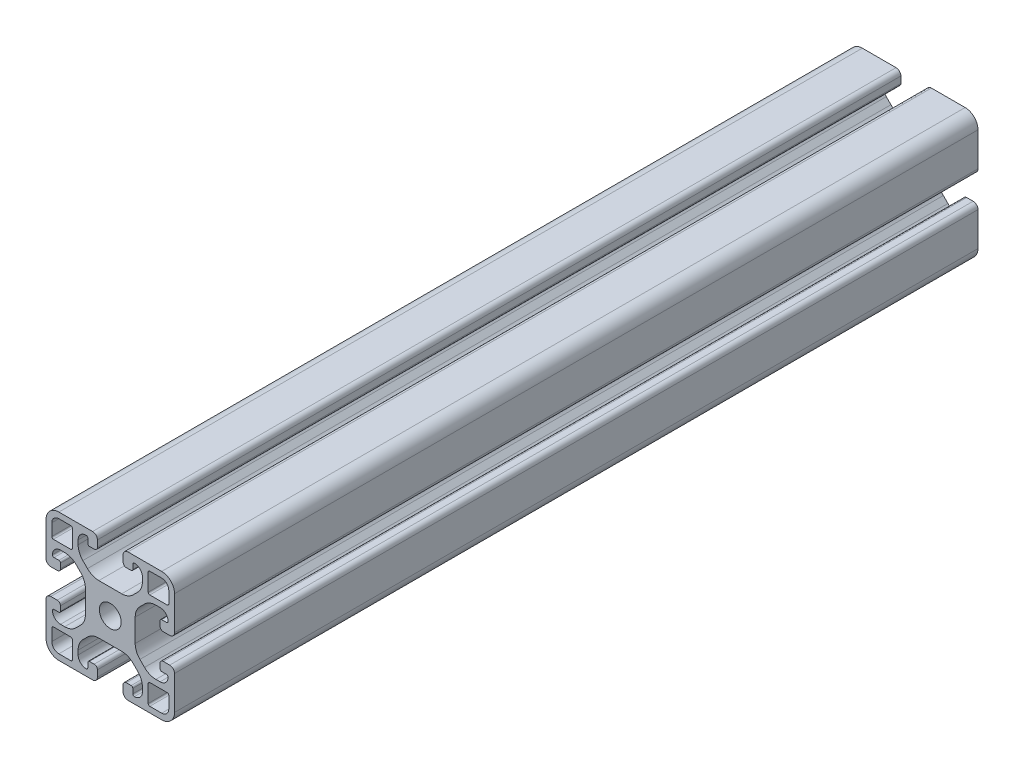
from build123d import *

# Parameters (mm, degrees)
SKETCH1_R           = 3.4
BOSS_EXTRUDE1_DEPTH = 250


with BuildPart() as part:
    # Sketch1 → Boss-Extrude1 (new body)
    with BuildSketch(Plane.XY):
        with BuildLine():
            Line((0, 36), (0, 25.5))
            ThreePointArc((0, 25.5), (0.439339828, 24.439339828), (1.5, 24))
            Line((1.5, 24), (3.5, 24))
            ThreePointArc((3.5, 24), (4.207106781, 24.292893219), (4.5, 25))
            Line((4.5, 25), (4.5, 26.5))
            ThreePointArc((4.5, 26.5), (4.353553391, 26.853553391), (4, 27))
            Line((4, 27), (2.5, 27))
            ThreePointArc((2.5, 27), (2.146446609, 27.146446609), (2, 27.5))
            ThreePointArc((2, 27.5), (2.732233047, 29.267766953), (4.5, 30))
            Line((4.5, 30), (5.807611845, 30))
            ThreePointArc((5.807611845, 30), (7.721029006, 29.619397663), (9.343145751, 28.535533906))
            Line((9.343145751, 28.535533906), (10.785533906, 27.093145751))
            ThreePointArc((10.785533906, 27.093145751), (11.869397663, 25.471029006), (12.25, 23.557611845))
            Line((12.25, 23.557611845), (12.25, 16.442388155))
            ThreePointArc((12.25, 16.442388155), (11.869397663, 14.528970994), (10.785533906, 12.906854249))
            Line((10.785533906, 12.906854249), (9.343145751, 11.464466094))
            ThreePointArc((9.343145751, 11.464466094), (7.721029006, 10.380602337), (5.807611845, 10))
            Line((5.807611845, 10), (4.5, 10))
            ThreePointArc((4.5, 10), (2.732233047, 10.732233047), (2, 12.5))
            ThreePointArc((2, 12.5), (2.146446609, 12.853553391), (2.5, 13))
            Line((2.5, 13), (4, 13))
            ThreePointArc((4, 13), (4.353553391, 13.146446609), (4.5, 13.5))
            Line((4.5, 13.5), (4.5, 15))
            ThreePointArc((4.5, 15), (4.207106781, 15.707106781), (3.5, 16))
            Line((3.5, 16), (1.5, 16))
            ThreePointArc((1.5, 16), (0.439339828, 15.560660172), (0, 14.5))
            Line((0, 14.5), (0, 4))
            ThreePointArc((0, 4), (1.171572875, 1.171572875), (4, 0))
            Line((4, 0), (14.5, 0))
            ThreePointArc((14.5, 0), (15.560660172, 0.439339828), (16, 1.5))
            Line((16, 1.5), (16, 3.5))
            ThreePointArc((16, 3.5), (15.707106781, 4.207106781), (15, 4.5))
            Line((15, 4.5), (13.5, 4.5))
            ThreePointArc((13.5, 4.5), (13.146446609, 4.353553391), (13, 4))
            Line((13, 4), (13, 2.5))
            ThreePointArc((13, 2.5), (12.853553391, 2.146446609), (12.5, 2))
            ThreePointArc((12.5, 2), (10.732233047, 2.732233047), (10, 4.5))
            Line((10, 4.5), (10, 5.807611845))
            ThreePointArc((10, 5.807611845), (10.380602337, 7.721029006), (11.464466094, 9.343145751))
            Line((11.464466094, 9.343145751), (12.906854249, 10.785533906))
            ThreePointArc((12.906854249, 10.785533906), (14.528970994, 11.869397663), (16.442388155, 12.25))
            Line((16.442388155, 12.25), (23.557611845, 12.25))
            ThreePointArc((23.557611845, 12.25), (25.471029006, 11.869397663), (27.093145751, 10.785533906))
            Line((27.093145751, 10.785533906), (28.535533906, 9.343145751))
            ThreePointArc((28.535533906, 9.343145751), (29.619397663, 7.721029006), (30, 5.807611845))
            Line((30, 5.807611845), (30, 4.5))
            ThreePointArc((30, 4.5), (29.267766953, 2.732233047), (27.5, 2))
            ThreePointArc((27.5, 2), (27.146446609, 2.146446609), (27, 2.5))
            Line((27, 2.5), (27, 4))
            ThreePointArc((27, 4), (26.853553391, 4.353553391), (26.5, 4.5))
            Line((26.5, 4.5), (25, 4.5))
            ThreePointArc((25, 4.5), (24.292893219, 4.207106781), (24, 3.5))
            Line((24, 3.5), (24, 1.5))
            ThreePointArc((24, 1.5), (24.439339828, 0.439339828), (25.5, 0))
            Line((25.5, 0), (36, 0))
            ThreePointArc((36, 0), (38.828427125, 1.171572875), (40, 4))
            Line((40, 4), (40, 14.5))
            ThreePointArc((40, 14.5), (39.560660172, 15.560660172), (38.5, 16))
            Line((38.5, 16), (36.5, 16))
            ThreePointArc((36.5, 16), (35.792893219, 15.707106781), (35.5, 15))
            Line((35.5, 15), (35.5, 13.5))
            ThreePointArc((35.5, 13.5), (35.646446609, 13.146446609), (36, 13))
            Line((36, 13), (37.5, 13))
            ThreePointArc((37.5, 13), (37.853553391, 12.853553391), (38, 12.5))
            ThreePointArc((38, 12.5), (37.267766953, 10.732233047), (35.5, 10))
            Line((35.5, 10), (34.192388155, 10))
            ThreePointArc((34.192388155, 10), (32.278970994, 10.380602337), (30.656854249, 11.464466094))
            Line((30.656854249, 11.464466094), (29.214466094, 12.906854249))
            ThreePointArc((29.214466094, 12.906854249), (28.130602337, 14.528970994), (27.75, 16.442388155))
            Line((27.75, 16.442388155), (27.75, 23.557611845))
            ThreePointArc((27.75, 23.557611845), (28.130602337, 25.471029006), (29.214466094, 27.093145751))
            Line((29.214466094, 27.093145751), (30.656854249, 28.535533906))
            ThreePointArc((30.656854249, 28.535533906), (32.278970994, 29.619397663), (34.192388155, 30))
            Line((34.192388155, 30), (35.5, 30))
            ThreePointArc((35.5, 30), (37.267766953, 29.267766953), (38, 27.5))
            ThreePointArc((38, 27.5), (37.853553391, 27.146446609), (37.5, 27))
            Line((37.5, 27), (36, 27))
            ThreePointArc((36, 27), (35.646446609, 26.853553391), (35.5, 26.5))
            Line((35.5, 26.5), (35.5, 25))
            ThreePointArc((35.5, 25), (35.792893219, 24.292893219), (36.5, 24))
            Line((36.5, 24), (38.5, 24))
            ThreePointArc((38.5, 24), (39.560660172, 24.439339828), (40, 25.5))
            Line((40, 25.5), (40, 36))
            ThreePointArc((40, 36), (38.828427125, 38.828427125), (36, 40))
            Line((36, 40), (25.5, 40))
            ThreePointArc((25.5, 40), (24.439339828, 39.560660172), (24, 38.5))
            Line((24, 38.5), (24, 36.5))
            ThreePointArc((24, 36.5), (24.292893219, 35.792893219), (25, 35.5))
            Line((25, 35.5), (26.5, 35.5))
            ThreePointArc((26.5, 35.5), (26.853553391, 35.646446609), (27, 36))
            Line((27, 36), (27, 37.5))
            ThreePointArc((27, 37.5), (27.146446609, 37.853553391), (27.5, 38))
            ThreePointArc((27.5, 38), (29.267766953, 37.267766953), (30, 35.5))
            Line((30, 35.5), (30, 34.192388155))
            ThreePointArc((30, 34.192388155), (29.619397663, 32.278970994), (28.535533906, 30.656854249))
            Line((28.535533906, 30.656854249), (27.093145751, 29.214466094))
            ThreePointArc((27.093145751, 29.214466094), (25.471029006, 28.130602337), (23.557611845, 27.75))
            Line((23.557611845, 27.75), (16.442388155, 27.75))
            ThreePointArc((16.442388155, 27.75), (14.528970994, 28.130602337), (12.906854249, 29.214466094))
            Line((12.906854249, 29.214466094), (11.464466094, 30.656854249))
            ThreePointArc((11.464466094, 30.656854249), (10.380602337, 32.278970994), (10, 34.192388155))
            Line((10, 34.192388155), (10, 35.5))
            ThreePointArc((10, 35.5), (10.732233047, 37.267766953), (12.5, 38))
            ThreePointArc((12.5, 38), (12.853553391, 37.853553391), (13, 37.5))
            Line((13, 37.5), (13, 36))
            ThreePointArc((13, 36), (13.146446609, 35.646446609), (13.5, 35.5))
            Line((13.5, 35.5), (15, 35.5))
            ThreePointArc((15, 35.5), (15.707106781, 35.792893219), (16, 36.5))
            Line((16, 36.5), (16, 38.5))
            ThreePointArc((16, 38.5), (15.560660172, 39.560660172), (14.5, 40))
            Line((14.5, 40), (4, 40))
            ThreePointArc((4, 40), (1.171572875, 38.828427125), (0, 36))
        make_face()
        with Locations(Location((20, 20, 0), (0, 0, 180))):
            Circle(SKETCH1_R, mode=Mode.SUBTRACT)
        with BuildLine():
            Line((1.8, 4), (1.8, 7.7))
            ThreePointArc((1.8, 7.7), (1.946446609, 8.053553391), (2.3, 8.2))
            Line((2.3, 8.2), (7.7, 8.2))
            ThreePointArc((7.7, 8.2), (8.053553391, 8.053553391), (8.2, 7.7))
            Line((8.2, 7.7), (8.2, 2.3))
            ThreePointArc((8.2, 2.3), (8.053553391, 1.946446609), (7.7, 1.8))
            Line((7.7, 1.8), (4, 1.8))
            ThreePointArc((4, 1.8), (2.444365081, 2.444365081), (1.8, 4))
        make_face(mode=Mode.SUBTRACT)
        with BuildLine():
            Line((4, 38.2), (7.7, 38.2))
            ThreePointArc((7.7, 38.2), (8.053553391, 38.053553391), (8.2, 37.7))
            Line((8.2, 37.7), (8.2, 32.3))
            ThreePointArc((8.2, 32.3), (8.053553391, 31.946446609), (7.7, 31.8))
            Line((7.7, 31.8), (2.3, 31.8))
            ThreePointArc((2.3, 31.8), (1.946446609, 31.946446609), (1.8, 32.3))
            Line((1.8, 32.3), (1.8, 36))
            ThreePointArc((1.8, 36), (2.444365081, 37.555634919), (4, 38.2))
        make_face(mode=Mode.SUBTRACT)
        with BuildLine():
            Line((31.8, 32.3), (31.8, 37.7))
            ThreePointArc((31.8, 37.7), (31.946446609, 38.053553391), (32.3, 38.2))
            Line((32.3, 38.2), (36, 38.2))
            ThreePointArc((36, 38.2), (37.555634919, 37.555634919), (38.2, 36))
            Line((38.2, 36), (38.2, 32.3))
            ThreePointArc((38.2, 32.3), (38.053553391, 31.946446609), (37.7, 31.8))
            Line((37.7, 31.8), (32.3, 31.8))
            ThreePointArc((32.3, 31.8), (31.946446609, 31.946446609), (31.8, 32.3))
        make_face(mode=Mode.SUBTRACT)
        with BuildLine():
            Line((32.3, 8.2), (37.7, 8.2))
            ThreePointArc((37.7, 8.2), (38.053553391, 8.053553391), (38.2, 7.7))
            Line((38.2, 7.7), (38.2, 4))
            ThreePointArc((38.2, 4), (37.555634919, 2.444365081), (36, 1.8))
            Line((36, 1.8), (32.3, 1.8))
            ThreePointArc((32.3, 1.8), (31.946446609, 1.946446609), (31.8, 2.3))
            Line((31.8, 2.3), (31.8, 7.7))
            ThreePointArc((31.8, 7.7), (31.946446609, 8.053553391), (32.3, 8.2))
        make_face(mode=Mode.SUBTRACT)
    extrude(amount=-BOSS_EXTRUDE1_DEPTH)


solid = part.part
